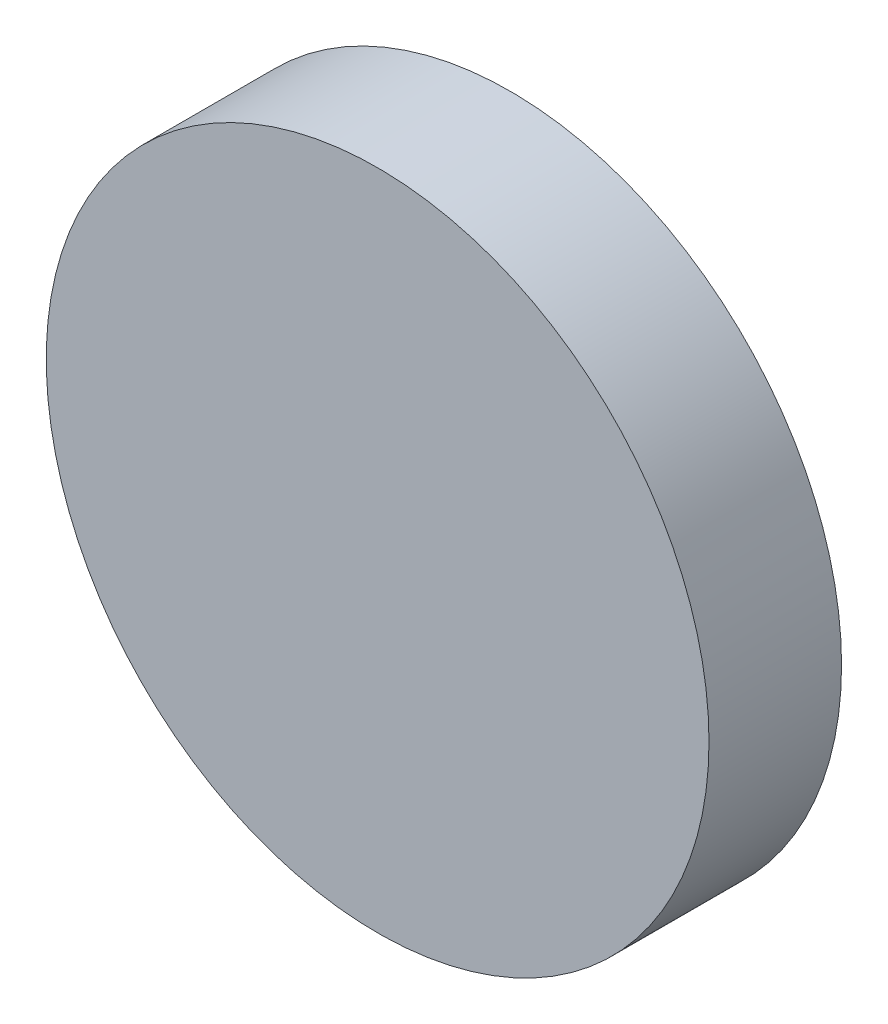
from build123d import *

# Parameters (mm, degrees)
SKETCH1_R           = 75
BOSS_EXTRUDE1_DEPTH = 30


with BuildPart() as part:
    # Sketch1 → Boss-Extrude1 (new body)
    with BuildSketch(Plane.XY):
        Circle(SKETCH1_R)
    extrude(amount=BOSS_EXTRUDE1_DEPTH)


solid = part.part
